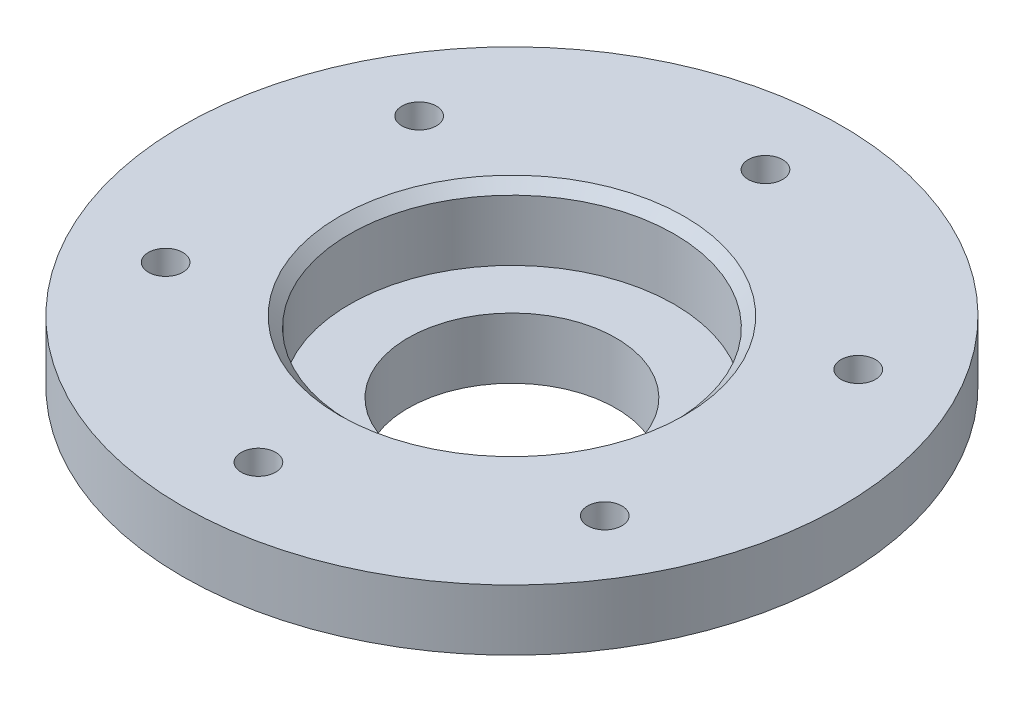
from build123d import *

# Parameters (mm, degrees)
FASE1_SIZE                                           = 1
FASE2_SIZE                                           = 1
FORMSENKUNG_F_R_M3_SENKSCHRAUBE_MIT_SCHL_D           = 3.4
FORMSENKUNG_F_R_M3_SENKSCHRAUBE_MIT_SCHL_CSINK_D     = 6.3
FORMSENKUNG_F_R_M3_SENKSCHRAUBE_MIT_SCHL_CSINK_ANGLE = 90
KREISMUSTER1_COUNT                                   = 6


with BuildPart() as part:
    # Skizze1 → Rotation1 (revolve)
    with BuildSketch(Plane.XY, mode=Mode.PRIVATE) as rotation1_sk:
        Polygon((10.25, 0), (20, 0), (20, 7), (32.5, 7), (32.5, 13), (16, 13), (16, 6), (10.25, 6), align=None)
    revolve(rotation1_sk.sketch.rotate(Axis((0, 0, 0), (0, -1, 0)), 90), axis=Axis((0, 0, 0), (0, -1, 0)))

    # Fase1
    fase1_edges = [part.edges().sort_by_distance(p)[0] for p in [
        (0, 13, -16),
    ]]
    chamfer(fase1_edges, length=FASE1_SIZE)

    # Fase2
    fase2_edges = [part.edges().sort_by_distance(p)[0] for p in [
        (0, 0, -20),
    ]]
    chamfer(fase2_edges, length=FASE2_SIZE)

    # Formsenkung für M3 Senkschraube mit Schlitz/Kreuzschlitz1 (through all)
    with Locations(Plane(origin=(0, 7, 0), x_dir=(-1, 0, 0), z_dir=(0, -1, 0))):
        with Locations((0, 25)):
            formsenkung_f_r_m3_senkschraube_mit_schl = CounterSinkHole(FORMSENKUNG_F_R_M3_SENKSCHRAUBE_MIT_SCHL_D / 2, FORMSENKUNG_F_R_M3_SENKSCHRAUBE_MIT_SCHL_CSINK_D / 2, counter_sink_angle=FORMSENKUNG_F_R_M3_SENKSCHRAUBE_MIT_SCHL_CSINK_ANGLE)

    # Kreismuster1: Formsenkung für M3 Senkschraube mit Schlitz/Kreuzschlitz1 ×6 about axis
    kreismuster1_axis = Axis((0, 0, 0), (0, 1, 0))
    for i in range(1, KREISMUSTER1_COUNT):
        add(formsenkung_f_r_m3_senkschraube_mit_schl.rotate(kreismuster1_axis, i * 360 / KREISMUSTER1_COUNT), mode=Mode.SUBTRACT)


solid = part.part
